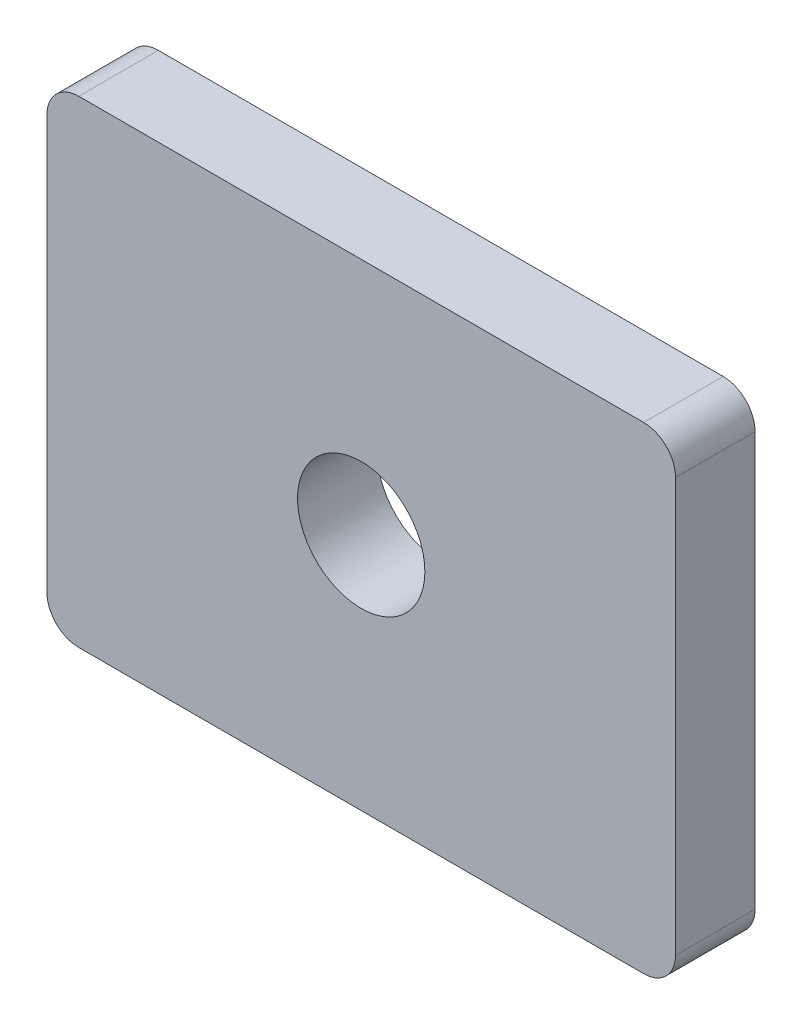
from build123d import *

# Parameters (mm, degrees)
SKETCH1_W           = 39.5
SKETCH1_H           = 30
SKETCH1_R           = 4
BOSS_EXTRUDE1_DEPTH = 5
FILLET1_R           = 2


with BuildPart() as part:
    # Sketch1 → Boss-Extrude1 (new body)
    with BuildSketch(Plane.XY):
        Rectangle(SKETCH1_W, SKETCH1_H)
        Circle(SKETCH1_R, mode=Mode.SUBTRACT)
    extrude(amount=BOSS_EXTRUDE1_DEPTH)

    # Fillet1
    fillet1_edges = [part.edges().sort_by_distance(p)[0] for p in [
        (19.75, -15, 2.5),
        (-19.75, -15, 2.5),
        (-19.75, 15, 2.5),
        (19.75, 15, 2.5),
    ]]
    fillet(fillet1_edges, radius=FILLET1_R)


solid = part.part
